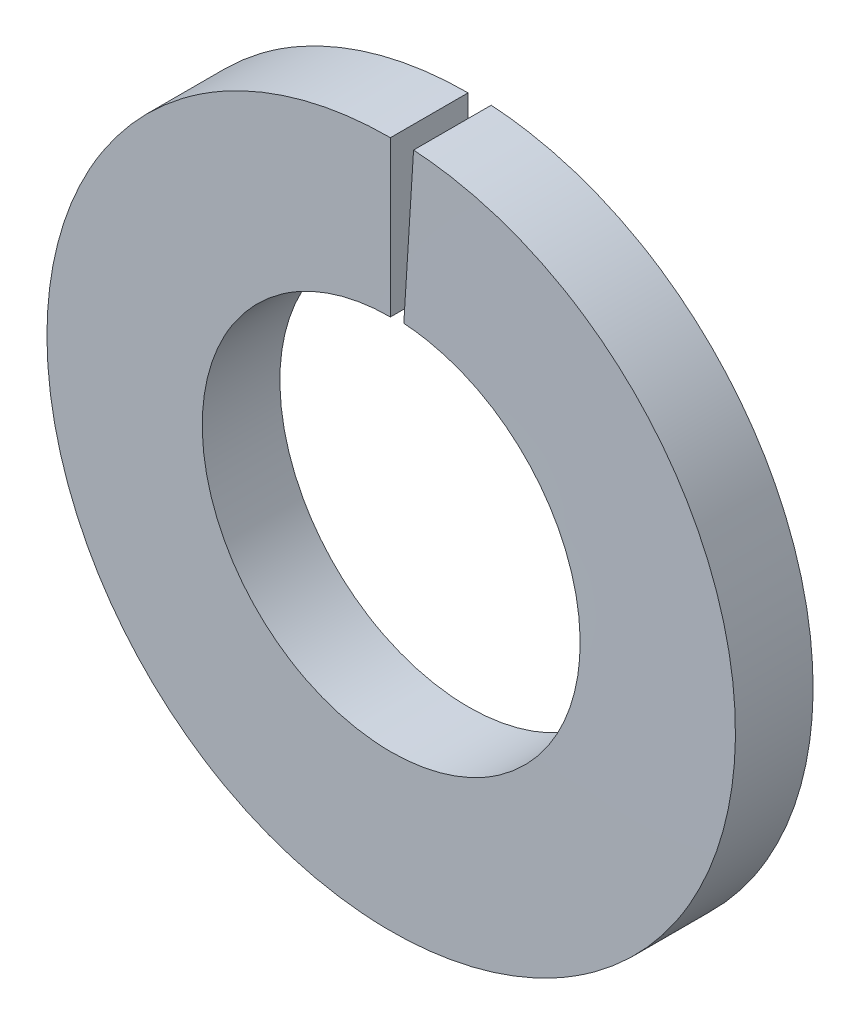
from build123d import *

# Parameters (mm, degrees)
SWEEP1_PITCH       = 0.014141414
SWEEP1_HEIGHT      = 0.014
SWEEP1_RADIUS      = 3.1
SWEEP1_START_ANGLE = 90
SKETCH2_W          = 0.7
SKETCH2_H          = 1.4


with BuildPart() as part:
    # Sweep1: sweep along a helix
    with BuildLine() as sweep1_path:
        add(Helix(SWEEP1_PITCH, SWEEP1_HEIGHT, SWEEP1_RADIUS, center=(0, 0, 0), direction=(0, 0, -1), lefthand=True, mode=Mode.PRIVATE).rotate(Axis((0, 0, 0), (0, 0, -1)), SWEEP1_START_ANGLE))
    # Sketch2 → Sweep1 (sweep)
    with BuildSketch(Plane(origin=(0, 0, 0), x_dir=(0, 0, -1), z_dir=(1, 0, 0))):
        with Locations((-0.35, 2.4)):
            Rectangle(SKETCH2_W, SKETCH2_H)
    sweep(path=sweep1_path.line, is_frenet=True)


solid = part.part
